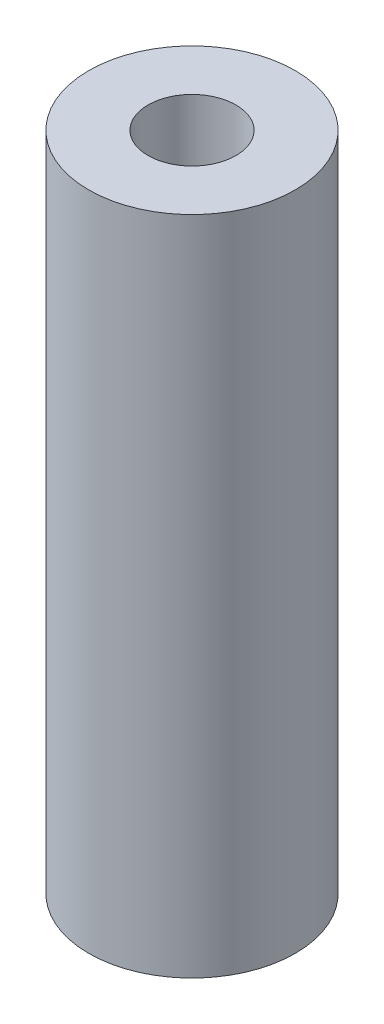
from build123d import *

# Parameters (mm, degrees)
SKETCH1_R           = 7.9375
SKETCH1_R_2         = 3.3734375
BOSS_EXTRUDE1_DEPTH = 50.8


with BuildPart() as part:
    # Sketch1 → Boss-Extrude1 (new body)
    with BuildSketch(Plane(origin=(0, 0, 0), x_dir=(1, 0, 0), z_dir=(0, 1, 0))):
        with Locations(Location((0, 0, 0), (0, 0, 270))):
            Circle(SKETCH1_R)
        with Locations(Location((0, 0, 0), (0, 0, 270))):
            Circle(SKETCH1_R_2, mode=Mode.SUBTRACT)
    extrude(amount=BOSS_EXTRUDE1_DEPTH)


solid = part.part
